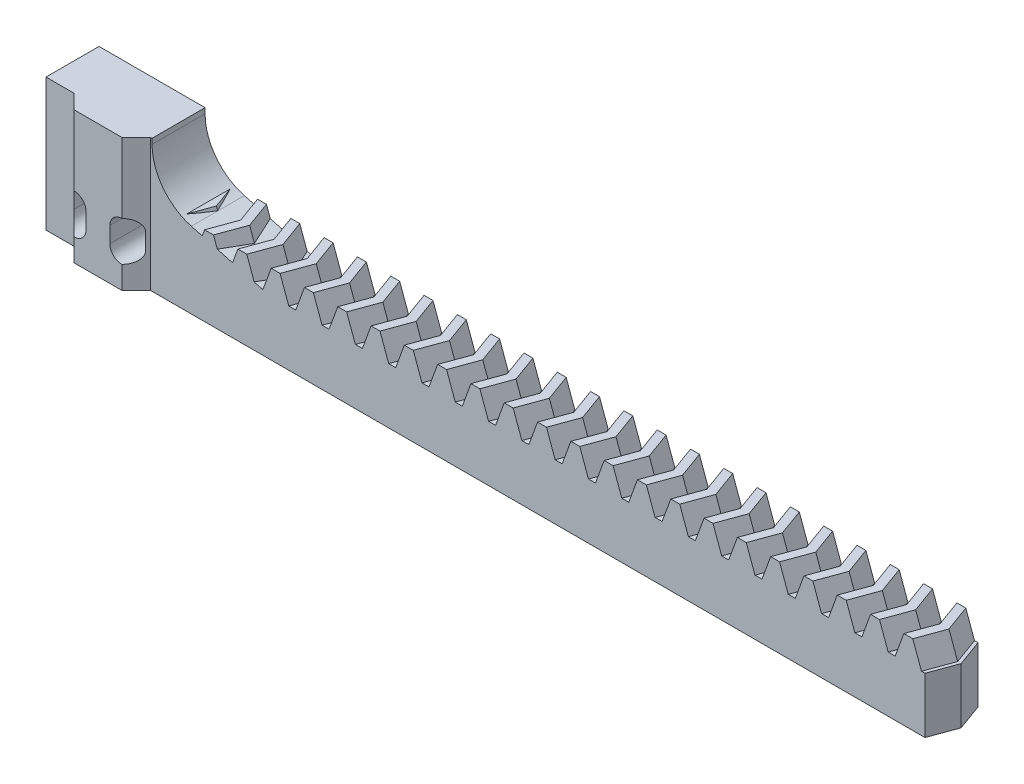
from build123d import *

# Parameters (mm, degrees)
LPATTERN2_COUNT     = 24
LPATTERN2_PITCH     = 6.28
BOSS_EXTRUDE1_START = -10
BOSS_EXTRUDE1_DEPTH = 10
BOSS_EXTRUDE2_DEPTH = 25
CUT_EXTRUDE1_DEPTH  = 149.833451885


with BuildPart() as part:
    # Sweep1: sweep along a path in Sketch2
    with BuildLine(Plane(origin=(0, 0, 0), x_dir=(1, 0, 0), z_dir=(0, 1, 0))) as sweep1_path:
        Line((0, 0), (-1.819851171, 5))
    # Sketch1 → Sweep1 (sweep)
    with BuildSketch(Plane.XY):
        Polygon((-3.14, -10.5), (3.14, -10.5), (3.14, 0), (2.479925586, 0), (0.842059531, 4.5), (-0.842059531, 4.5), (-2.479925586, 0), (-3.14, 0), align=None)
    sweep1 = sweep(path=sweep1_path.line)

    # Mirror2: Sweep1 across plane
    add(sweep1.mirror(Plane.XY))

    # LPattern2: Sweep1 ×24
    with Locations(*[(i * LPATTERN2_PITCH, 0, 0) for i in range(1, LPATTERN2_COUNT)]):
        add(sweep1)

    # LPattern2 copy 1: sweep along a path in LPattern2 copy 1 path
    with BuildLine(Plane(origin=(6.28, 0, 0), x_dir=(1, 0, 0), z_dir=(0, 1, 0))) as lpattern2_copy_1_path:
        Line((0, 0), (-1.819851171, -5))
    # LPattern2 copy 1 sketch → LPattern2 copy 1 (sweep)
    with BuildSketch(Plane(origin=(6.28, 0, 0), x_dir=(1, 0, 0), z_dir=(0, 0, -1))):
        Polygon((-3.14, 10.5), (3.14, 10.5), (3.14, 0), (2.479925586, 0), (0.842059531, -4.5), (-0.842059531, -4.5), (-2.479925586, 0), (-3.14, 0), align=None)
    sweep(path=lpattern2_copy_1_path.line)

    # LPattern2 copy 2: sweep along a path in LPattern2 copy 2 path
    with BuildLine(Plane(origin=(12.56, 0, 0), x_dir=(1, 0, 0), z_dir=(0, 1, 0))) as lpattern2_copy_2_path:
        Line((0, 0), (-1.819851171, -5))
    # LPattern2 copy 2 sketch → LPattern2 copy 2 (sweep)
    with BuildSketch(Plane(origin=(12.56, 0, 0), x_dir=(1, 0, 0), z_dir=(0, 0, -1))):
        Polygon((-3.14, 10.5), (3.14, 10.5), (3.14, 0), (2.479925586, 0), (0.842059531, -4.5), (-0.842059531, -4.5), (-2.479925586, 0), (-3.14, 0), align=None)
    sweep(path=lpattern2_copy_2_path.line)

    # LPattern2 copy 3: sweep along a path in LPattern2 copy 3 path
    with BuildLine(Plane(origin=(18.84, 0, 0), x_dir=(1, 0, 0), z_dir=(0, 1, 0))) as lpattern2_copy_3_path:
        Line((0, 0), (-1.819851171, -5))
    # LPattern2 copy 3 sketch → LPattern2 copy 3 (sweep)
    with BuildSketch(Plane(origin=(18.84, 0, 0), x_dir=(1, 0, 0), z_dir=(0, 0, -1))):
        Polygon((-3.14, 10.5), (3.14, 10.5), (3.14, 0), (2.479925586, 0), (0.842059531, -4.5), (-0.842059531, -4.5), (-2.479925586, 0), (-3.14, 0), align=None)
    sweep(path=lpattern2_copy_3_path.line)

    # LPattern2 copy 4: sweep along a path in LPattern2 copy 4 path
    with BuildLine(Plane(origin=(25.12, 0, 0), x_dir=(1, 0, 0), z_dir=(0, 1, 0))) as lpattern2_copy_4_path:
        Line((0, 0), (-1.819851171, -5))
    # LPattern2 copy 4 sketch → LPattern2 copy 4 (sweep)
    with BuildSketch(Plane(origin=(25.12, 0, 0), x_dir=(1, 0, 0), z_dir=(0, 0, -1))):
        Polygon((-3.14, 10.5), (3.14, 10.5), (3.14, 0), (2.479925586, 0), (0.842059531, -4.5), (-0.842059531, -4.5), (-2.479925586, 0), (-3.14, 0), align=None)
    sweep(path=lpattern2_copy_4_path.line)

    # LPattern2 copy 5: sweep along a path in LPattern2 copy 5 path
    with BuildLine(Plane(origin=(31.4, 0, 0), x_dir=(1, 0, 0), z_dir=(0, 1, 0))) as lpattern2_copy_5_path:
        Line((0, 0), (-1.819851171, -5))
    # LPattern2 copy 5 sketch → LPattern2 copy 5 (sweep)
    with BuildSketch(Plane(origin=(31.4, 0, 0), x_dir=(1, 0, 0), z_dir=(0, 0, -1))):
        Polygon((-3.14, 10.5), (3.14, 10.5), (3.14, 0), (2.479925586, 0), (0.842059531, -4.5), (-0.842059531, -4.5), (-2.479925586, 0), (-3.14, 0), align=None)
    sweep(path=lpattern2_copy_5_path.line)

    # LPattern2 copy 6: sweep along a path in LPattern2 copy 6 path
    with BuildLine(Plane(origin=(37.68, 0, 0), x_dir=(1, 0, 0), z_dir=(0, 1, 0))) as lpattern2_copy_6_path:
        Line((0, 0), (-1.819851171, -5))
    # LPattern2 copy 6 sketch → LPattern2 copy 6 (sweep)
    with BuildSketch(Plane(origin=(37.68, 0, 0), x_dir=(1, 0, 0), z_dir=(0, 0, -1))):
        Polygon((-3.14, 10.5), (3.14, 10.5), (3.14, 0), (2.479925586, 0), (0.842059531, -4.5), (-0.842059531, -4.5), (-2.479925586, 0), (-3.14, 0), align=None)
    sweep(path=lpattern2_copy_6_path.line)

    # LPattern2 copy 7: sweep along a path in LPattern2 copy 7 path
    with BuildLine(Plane(origin=(43.96, 0, 0), x_dir=(1, 0, 0), z_dir=(0, 1, 0))) as lpattern2_copy_7_path:
        Line((0, 0), (-1.819851171, -5))
    # LPattern2 copy 7 sketch → LPattern2 copy 7 (sweep)
    with BuildSketch(Plane(origin=(43.96, 0, 0), x_dir=(1, 0, 0), z_dir=(0, 0, -1))):
        Polygon((-3.14, 10.5), (3.14, 10.5), (3.14, 0), (2.479925586, 0), (0.842059531, -4.5), (-0.842059531, -4.5), (-2.479925586, 0), (-3.14, 0), align=None)
    sweep(path=lpattern2_copy_7_path.line)

    # LPattern2 copy 8: sweep along a path in LPattern2 copy 8 path
    with BuildLine(Plane(origin=(50.24, 0, 0), x_dir=(1, 0, 0), z_dir=(0, 1, 0))) as lpattern2_copy_8_path:
        Line((0, 0), (-1.819851171, -5))
    # LPattern2 copy 8 sketch → LPattern2 copy 8 (sweep)
    with BuildSketch(Plane(origin=(50.24, 0, 0), x_dir=(1, 0, 0), z_dir=(0, 0, -1))):
        Polygon((-3.14, 10.5), (3.14, 10.5), (3.14, 0), (2.479925586, 0), (0.842059531, -4.5), (-0.842059531, -4.5), (-2.479925586, 0), (-3.14, 0), align=None)
    sweep(path=lpattern2_copy_8_path.line)

    # LPattern2 copy 9: sweep along a path in LPattern2 copy 9 path
    with BuildLine(Plane(origin=(56.52, 0, 0), x_dir=(1, 0, 0), z_dir=(0, 1, 0))) as lpattern2_copy_9_path:
        Line((0, 0), (-1.819851171, -5))
    # LPattern2 copy 9 sketch → LPattern2 copy 9 (sweep)
    with BuildSketch(Plane(origin=(56.52, 0, 0), x_dir=(1, 0, 0), z_dir=(0, 0, -1))):
        Polygon((-3.14, 10.5), (3.14, 10.5), (3.14, 0), (2.479925586, 0), (0.842059531, -4.5), (-0.842059531, -4.5), (-2.479925586, 0), (-3.14, 0), align=None)
    sweep(path=lpattern2_copy_9_path.line)

    # LPattern2 copy 10: sweep along a path in LPattern2 copy 10 path
    with BuildLine(Plane(origin=(62.8, 0, 0), x_dir=(1, 0, 0), z_dir=(0, 1, 0))) as lpattern2_copy_10_path:
        Line((0, 0), (-1.819851171, -5))
    # LPattern2 copy 10 sketch → LPattern2 copy 10 (sweep)
    with BuildSketch(Plane(origin=(62.8, 0, 0), x_dir=(1, 0, 0), z_dir=(0, 0, -1))):
        Polygon((-3.14, 10.5), (3.14, 10.5), (3.14, 0), (2.479925586, 0), (0.842059531, -4.5), (-0.842059531, -4.5), (-2.479925586, 0), (-3.14, 0), align=None)
    sweep(path=lpattern2_copy_10_path.line)

    # LPattern2 copy 11: sweep along a path in LPattern2 copy 11 path
    with BuildLine(Plane(origin=(69.08, 0, 0), x_dir=(1, 0, 0), z_dir=(0, 1, 0))) as lpattern2_copy_11_path:
        Line((0, 0), (-1.819851171, -5))
    # LPattern2 copy 11 sketch → LPattern2 copy 11 (sweep)
    with BuildSketch(Plane(origin=(69.08, 0, 0), x_dir=(1, 0, 0), z_dir=(0, 0, -1))):
        Polygon((-3.14, 10.5), (3.14, 10.5), (3.14, 0), (2.479925586, 0), (0.842059531, -4.5), (-0.842059531, -4.5), (-2.479925586, 0), (-3.14, 0), align=None)
    sweep(path=lpattern2_copy_11_path.line)

    # LPattern2 copy 12: sweep along a path in LPattern2 copy 12 path
    with BuildLine(Plane(origin=(75.36, 0, 0), x_dir=(1, 0, 0), z_dir=(0, 1, 0))) as lpattern2_copy_12_path:
        Line((0, 0), (-1.819851171, -5))
    # LPattern2 copy 12 sketch → LPattern2 copy 12 (sweep)
    with BuildSketch(Plane(origin=(75.36, 0, 0), x_dir=(1, 0, 0), z_dir=(0, 0, -1))):
        Polygon((-3.14, 10.5), (3.14, 10.5), (3.14, 0), (2.479925586, 0), (0.842059531, -4.5), (-0.842059531, -4.5), (-2.479925586, 0), (-3.14, 0), align=None)
    sweep(path=lpattern2_copy_12_path.line)

    # LPattern2 copy 13: sweep along a path in LPattern2 copy 13 path
    with BuildLine(Plane(origin=(81.64, 0, 0), x_dir=(1, 0, 0), z_dir=(0, 1, 0))) as lpattern2_copy_13_path:
        Line((0, 0), (-1.819851171, -5))
    # LPattern2 copy 13 sketch → LPattern2 copy 13 (sweep)
    with BuildSketch(Plane(origin=(81.64, 0, 0), x_dir=(1, 0, 0), z_dir=(0, 0, -1))):
        Polygon((-3.14, 10.5), (3.14, 10.5), (3.14, 0), (2.479925586, 0), (0.842059531, -4.5), (-0.842059531, -4.5), (-2.479925586, 0), (-3.14, 0), align=None)
    sweep(path=lpattern2_copy_13_path.line)

    # LPattern2 copy 14: sweep along a path in LPattern2 copy 14 path
    with BuildLine(Plane(origin=(87.92, 0, 0), x_dir=(1, 0, 0), z_dir=(0, 1, 0))) as lpattern2_copy_14_path:
        Line((0, 0), (-1.819851171, -5))
    # LPattern2 copy 14 sketch → LPattern2 copy 14 (sweep)
    with BuildSketch(Plane(origin=(87.92, 0, 0), x_dir=(1, 0, 0), z_dir=(0, 0, -1))):
        Polygon((-3.14, 10.5), (3.14, 10.5), (3.14, 0), (2.479925586, 0), (0.842059531, -4.5), (-0.842059531, -4.5), (-2.479925586, 0), (-3.14, 0), align=None)
    sweep(path=lpattern2_copy_14_path.line)

    # LPattern2 copy 15: sweep along a path in LPattern2 copy 15 path
    with BuildLine(Plane(origin=(94.2, 0, 0), x_dir=(1, 0, 0), z_dir=(0, 1, 0))) as lpattern2_copy_15_path:
        Line((0, 0), (-1.819851171, -5))
    # LPattern2 copy 15 sketch → LPattern2 copy 15 (sweep)
    with BuildSketch(Plane(origin=(94.2, 0, 0), x_dir=(1, 0, 0), z_dir=(0, 0, -1))):
        Polygon((-3.14, 10.5), (3.14, 10.5), (3.14, 0), (2.479925586, 0), (0.842059531, -4.5), (-0.842059531, -4.5), (-2.479925586, 0), (-3.14, 0), align=None)
    sweep(path=lpattern2_copy_15_path.line)

    # LPattern2 copy 16: sweep along a path in LPattern2 copy 16 path
    with BuildLine(Plane(origin=(100.48, 0, 0), x_dir=(1, 0, 0), z_dir=(0, 1, 0))) as lpattern2_copy_16_path:
        Line((0, 0), (-1.819851171, -5))
    # LPattern2 copy 16 sketch → LPattern2 copy 16 (sweep)
    with BuildSketch(Plane(origin=(100.48, 0, 0), x_dir=(1, 0, 0), z_dir=(0, 0, -1))):
        Polygon((-3.14, 10.5), (3.14, 10.5), (3.14, 0), (2.479925586, 0), (0.842059531, -4.5), (-0.842059531, -4.5), (-2.479925586, 0), (-3.14, 0), align=None)
    sweep(path=lpattern2_copy_16_path.line)

    # LPattern2 copy 17: sweep along a path in LPattern2 copy 17 path
    with BuildLine(Plane(origin=(106.76, 0, 0), x_dir=(1, 0, 0), z_dir=(0, 1, 0))) as lpattern2_copy_17_path:
        Line((0, 0), (-1.819851171, -5))
    # LPattern2 copy 17 sketch → LPattern2 copy 17 (sweep)
    with BuildSketch(Plane(origin=(106.76, 0, 0), x_dir=(1, 0, 0), z_dir=(0, 0, -1))):
        Polygon((-3.14, 10.5), (3.14, 10.5), (3.14, 0), (2.479925586, 0), (0.842059531, -4.5), (-0.842059531, -4.5), (-2.479925586, 0), (-3.14, 0), align=None)
    sweep(path=lpattern2_copy_17_path.line)

    # LPattern2 copy 18: sweep along a path in LPattern2 copy 18 path
    with BuildLine(Plane(origin=(113.04, 0, 0), x_dir=(1, 0, 0), z_dir=(0, 1, 0))) as lpattern2_copy_18_path:
        Line((0, 0), (-1.819851171, -5))
    # LPattern2 copy 18 sketch → LPattern2 copy 18 (sweep)
    with BuildSketch(Plane(origin=(113.04, 0, 0), x_dir=(1, 0, 0), z_dir=(0, 0, -1))):
        Polygon((-3.14, 10.5), (3.14, 10.5), (3.14, 0), (2.479925586, 0), (0.842059531, -4.5), (-0.842059531, -4.5), (-2.479925586, 0), (-3.14, 0), align=None)
    sweep(path=lpattern2_copy_18_path.line)

    # LPattern2 copy 19: sweep along a path in LPattern2 copy 19 path
    with BuildLine(Plane(origin=(119.32, 0, 0), x_dir=(1, 0, 0), z_dir=(0, 1, 0))) as lpattern2_copy_19_path:
        Line((0, 0), (-1.819851171, -5))
    # LPattern2 copy 19 sketch → LPattern2 copy 19 (sweep)
    with BuildSketch(Plane(origin=(119.32, 0, 0), x_dir=(1, 0, 0), z_dir=(0, 0, -1))):
        Polygon((-3.14, 10.5), (3.14, 10.5), (3.14, 0), (2.479925586, 0), (0.842059531, -4.5), (-0.842059531, -4.5), (-2.479925586, 0), (-3.14, 0), align=None)
    sweep(path=lpattern2_copy_19_path.line)

    # LPattern2 copy 20: sweep along a path in LPattern2 copy 20 path
    with BuildLine(Plane(origin=(125.6, 0, 0), x_dir=(1, 0, 0), z_dir=(0, 1, 0))) as lpattern2_copy_20_path:
        Line((0, 0), (-1.819851171, -5))
    # LPattern2 copy 20 sketch → LPattern2 copy 20 (sweep)
    with BuildSketch(Plane(origin=(125.6, 0, 0), x_dir=(1, 0, 0), z_dir=(0, 0, -1))):
        Polygon((-3.14, 10.5), (3.14, 10.5), (3.14, 0), (2.479925586, 0), (0.842059531, -4.5), (-0.842059531, -4.5), (-2.479925586, 0), (-3.14, 0), align=None)
    sweep(path=lpattern2_copy_20_path.line)

    # LPattern2 copy 21: sweep along a path in LPattern2 copy 21 path
    with BuildLine(Plane(origin=(131.88, 0, 0), x_dir=(1, 0, 0), z_dir=(0, 1, 0))) as lpattern2_copy_21_path:
        Line((0, 0), (-1.819851171, -5))
    # LPattern2 copy 21 sketch → LPattern2 copy 21 (sweep)
    with BuildSketch(Plane(origin=(131.88, 0, 0), x_dir=(1, 0, 0), z_dir=(0, 0, -1))):
        Polygon((-3.14, 10.5), (3.14, 10.5), (3.14, 0), (2.479925586, 0), (0.842059531, -4.5), (-0.842059531, -4.5), (-2.479925586, 0), (-3.14, 0), align=None)
    sweep(path=lpattern2_copy_21_path.line)

    # LPattern2 copy 22: sweep along a path in LPattern2 copy 22 path
    with BuildLine(Plane(origin=(138.16, 0, 0), x_dir=(1, 0, 0), z_dir=(0, 1, 0))) as lpattern2_copy_22_path:
        Line((0, 0), (-1.819851171, -5))
    # LPattern2 copy 22 sketch → LPattern2 copy 22 (sweep)
    with BuildSketch(Plane(origin=(138.16, 0, 0), x_dir=(1, 0, 0), z_dir=(0, 0, -1))):
        Polygon((-3.14, 10.5), (3.14, 10.5), (3.14, 0), (2.479925586, 0), (0.842059531, -4.5), (-0.842059531, -4.5), (-2.479925586, 0), (-3.14, 0), align=None)
    sweep(path=lpattern2_copy_22_path.line)

    # LPattern2 copy 23: sweep along a path in LPattern2 copy 23 path
    with BuildLine(Plane(origin=(144.44, 0, 0), x_dir=(1, 0, 0), z_dir=(0, 1, 0))) as lpattern2_copy_23_path:
        Line((0, 0), (-1.819851171, -5))
    # LPattern2 copy 23 sketch → LPattern2 copy 23 (sweep)
    with BuildSketch(Plane(origin=(144.44, 0, 0), x_dir=(1, 0, 0), z_dir=(0, 0, -1))):
        Polygon((-3.14, 10.5), (3.14, 10.5), (3.14, 0), (2.479925586, 0), (0.842059531, -4.5), (-0.842059531, -4.5), (-2.479925586, 0), (-3.14, 0), align=None)
    sweep(path=lpattern2_copy_23_path.line)

    # Sketch3 → Boss-Extrude1 (add)
    with BuildSketch(Plane.XY.offset(5).offset(BOSS_EXTRUDE1_START)):
        with BuildLine():
            ThreePointArc((7.411809549, 3.840741737), (2.066466597, 7.41238571), (0, 13.5))
            Line((0, 13.5), (0, 14.5))
            Line((0, 14.5), (-20, 14.5))
            Line((-20, 14.5), (-20, -10.5))
            Line((-20, -10.5), (0, -10.5))
            Line((0, -10.5), (21.745652851, -10.5))
            Line((21.745652851, -10.5), (21.745652851, 0))
            Line((21.745652851, 0), (7.411809549, 3.840741737))
        make_face()
    extrude(amount=BOSS_EXTRUDE1_DEPTH)

    # Sketch4 → Boss-Extrude2 (add)
    with BuildSketch(Plane(origin=(0, 14.5, 0), x_dir=(1, 0, 0), z_dir=(0, 1, 0))):
        Polygon((-14.7, -5), (-12, -7.7), (-3, -7.7), (-0.3, -5), align=None)
    extrude(amount=-BOSS_EXTRUDE2_DEPTH)

    # Sketch5 → Cut-Extrude1 (cut, through all)
    with BuildSketch(Plane.XY.offset(7.7)):
        with BuildLine():
            Line((-5.25, -4), (-5.25, -1))
            ThreePointArc((-5.25, -1), (-3, 1.25), (-0.75, -1))
            Line((-0.75, -1), (-0.75, -4))
            ThreePointArc((-0.75, -4), (-3, -6.25), (-5.25, -4))
        make_face()
        with BuildLine():
            Line((-14.25, -4), (-14.25, -1))
            ThreePointArc((-14.25, -1), (-12, 1.25), (-9.75, -1))
            Line((-9.75, -1), (-9.75, -4))
            ThreePointArc((-9.75, -4), (-12, -6.25), (-14.25, -4))
        make_face()
    extrude(amount=-CUT_EXTRUDE1_DEPTH, mode=Mode.SUBTRACT)


solid = part.part
